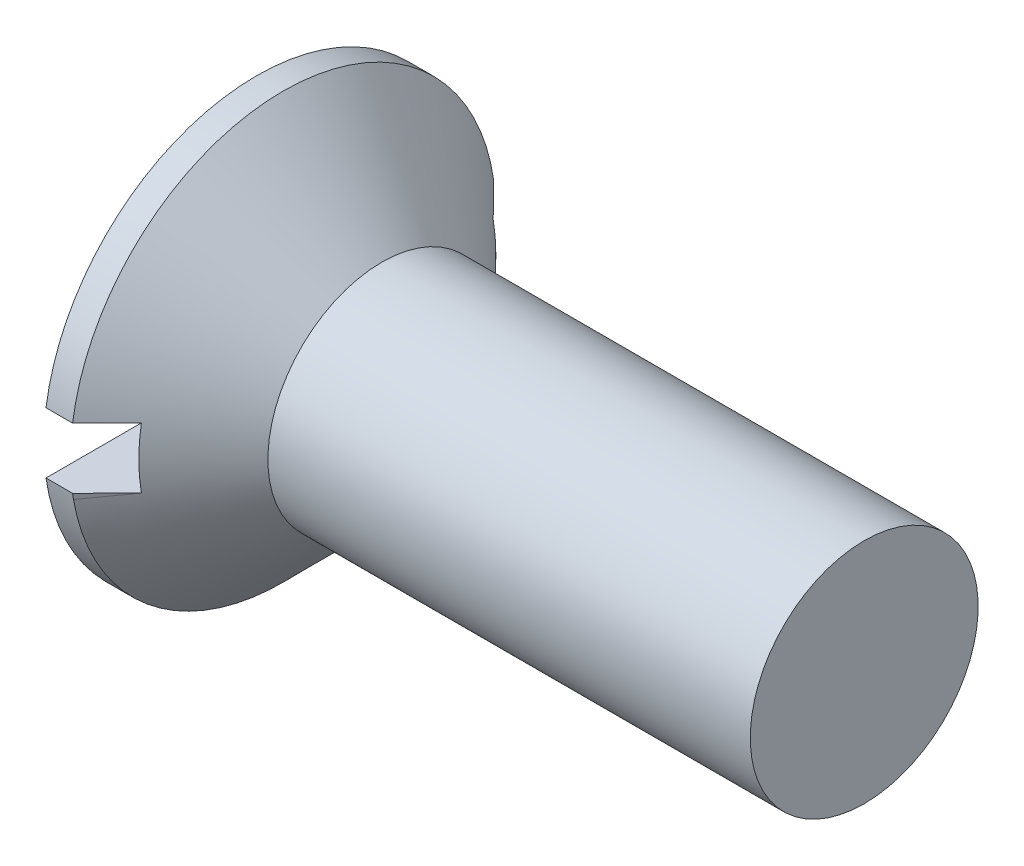
from build123d import *

# Parameters (mm, degrees)
SKETCH2_W          = 5.6
SKETCH2_H          = 0.8
CUT_EXTRUDE1_DEPTH = 0.8


with BuildPart() as part:
    # Sketch1 → Revolve1 (revolve)
    with BuildSketch(Plane.XY):
        Polygon((0, 0), (0, 2.8), (0.35, 2.8), (1.65, 1.5), (8, 1.5), (8, 0), align=None)
    revolve(axis=Axis((8, 0, 0), (-1, 0, 0)))

    # Sketch2 → Cut-Extrude1 (cut)
    with BuildSketch(Plane.ZY):
        Rectangle(SKETCH2_W, SKETCH2_H)
    extrude(amount=-CUT_EXTRUDE1_DEPTH, mode=Mode.SUBTRACT)


solid = part.part
